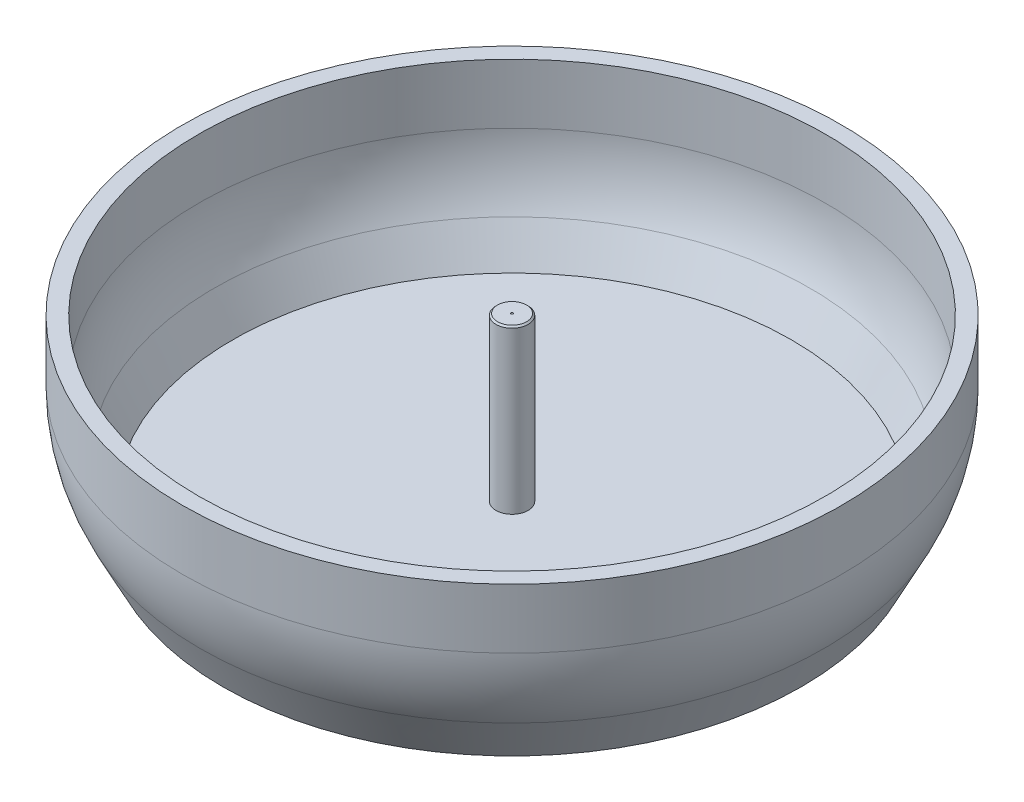
from build123d import *


with BuildPart() as part:
    # Croquis3 → Revolución3 (revolve)
    with BuildSketch(Plane.XY, mode=Mode.PRIVATE) as revoluci_n3_sk:
        with BuildLine():
            Line((0, 0), (90.123101889, 0))
            Line((90.123101889, 0), (97.195601882, 13.872079708))
            ThreePointArc((97.195601882, 13.872079708), (101.267943582, 24.904342215), (102.650891411, 36.582622834))
            Line((102.650891411, 36.582622834), (102.650891411, 55.195630425))
            Line((102.650891411, 55.195630425), (97.650891411, 55.195630425))
            Line((97.650891411, 55.195630425), (97.650891411, 36.582622834))
            ThreePointArc((97.650891411, 36.582622834), (96.406238365, 26.072170277), (92.741130835, 16.143134021))
            Line((92.741130835, 16.143134021), (87.059948421, 5))
            Line((87.059948421, 5), (5, 5))
            Line((5, 5), (5, 55.195630425))
            Line((5, 55.195630425), (4.518270437, 55.677359988))
            Line((4.518270437, 55.677359988), (0.335866273, 55.677359988))
            Line((0.335866273, 55.677359988), (0, 55.195630425))
            Line((0, 55.195630425), (0, 0))
        make_face()
    revolve(revoluci_n3_sk.sketch.rotate(Axis((0, 55.195630425, 0), (0, -1, 0)), 90), axis=Axis((0, 55.195630425, 0), (0, -1, 0)))


solid = part.part
